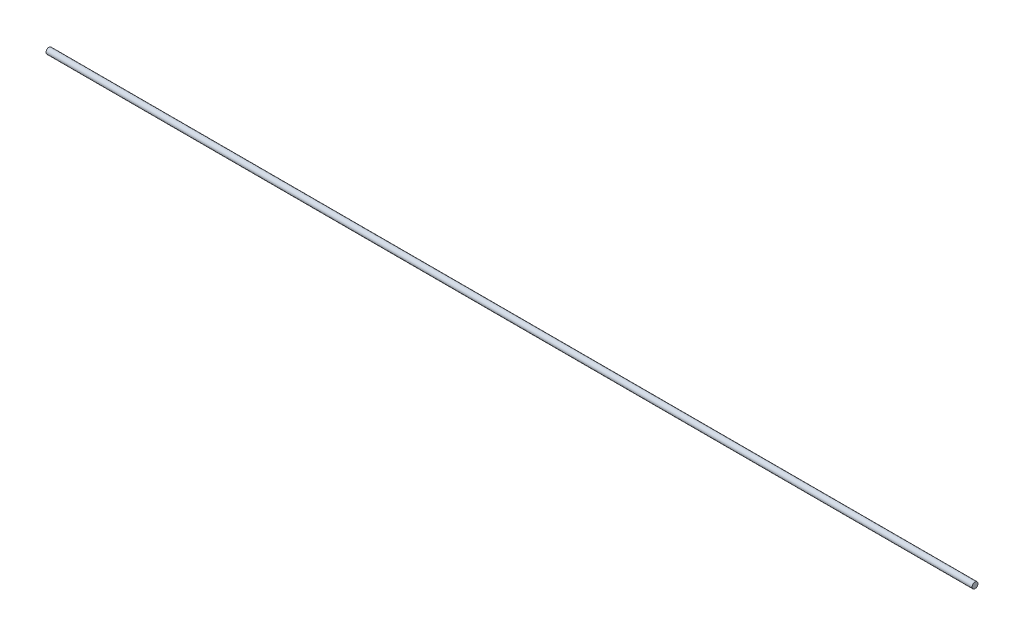
from build123d import *

# Parameters (mm, degrees)
SKETCH1_R           = 1.5875
BOSS_EXTRUDE1_DEPTH = 499.999


with BuildPart() as part:
    # Sketch1 → Boss-Extrude1 (new body)
    with BuildSketch(Plane(origin=(0, 0, 0), x_dir=(0, 0, -1), z_dir=(1, 0, 0))):
        with Locations(Location((0, 0, 0), (0, 0, 180))):
            Circle(SKETCH1_R)
    extrude(amount=BOSS_EXTRUDE1_DEPTH)


solid = part.part
